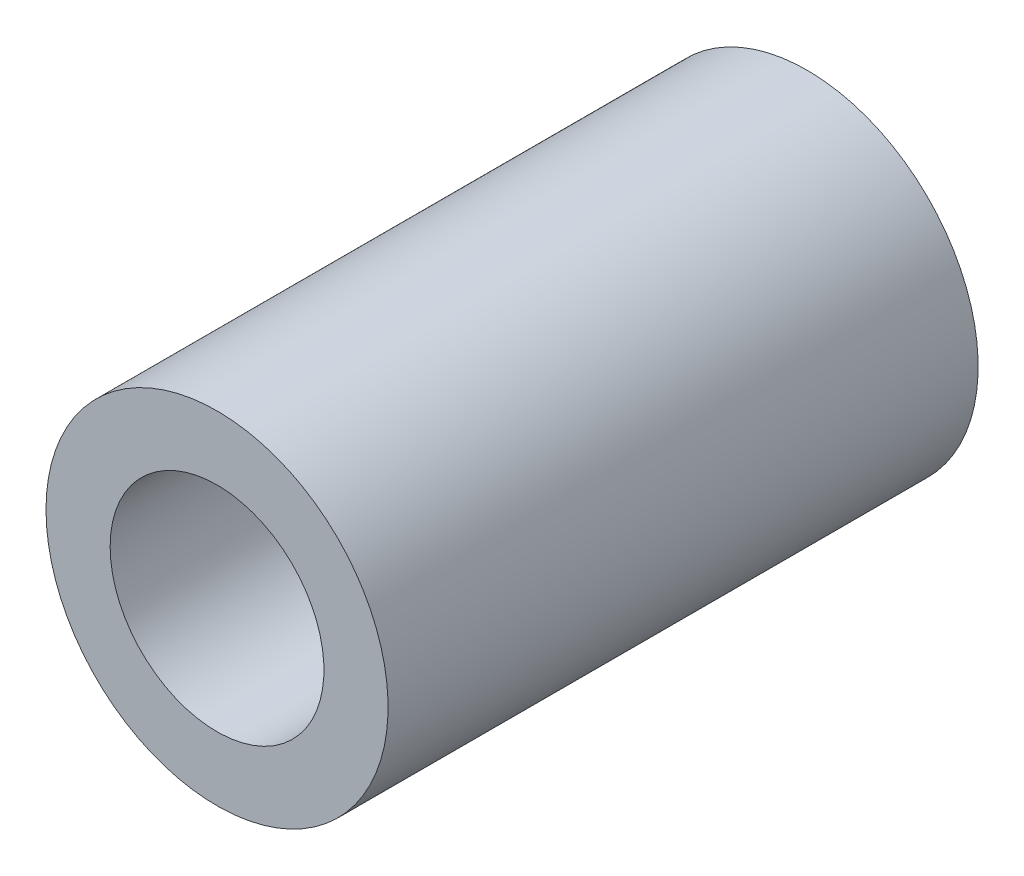
from build123d import *

# Parameters (mm, degrees)
SKETCH_1_R      = 4
SKETCH_1_R_2    = 2.5
EXTRUDE_1_DEPTH = 13.8


with BuildPart() as part:
    # 草图1 → 凸台-拉伸1 (new body)
    with BuildSketch(Plane.XY):
        with Locations(Location((0, 0, 0), (0, 0, 180))):
            Circle(SKETCH_1_R)
        with Locations(Location((0, 0, 0), (0, 0, 180))):
            Circle(SKETCH_1_R_2, mode=Mode.SUBTRACT)
    extrude(amount=EXTRUDE_1_DEPTH)


solid = part.part
